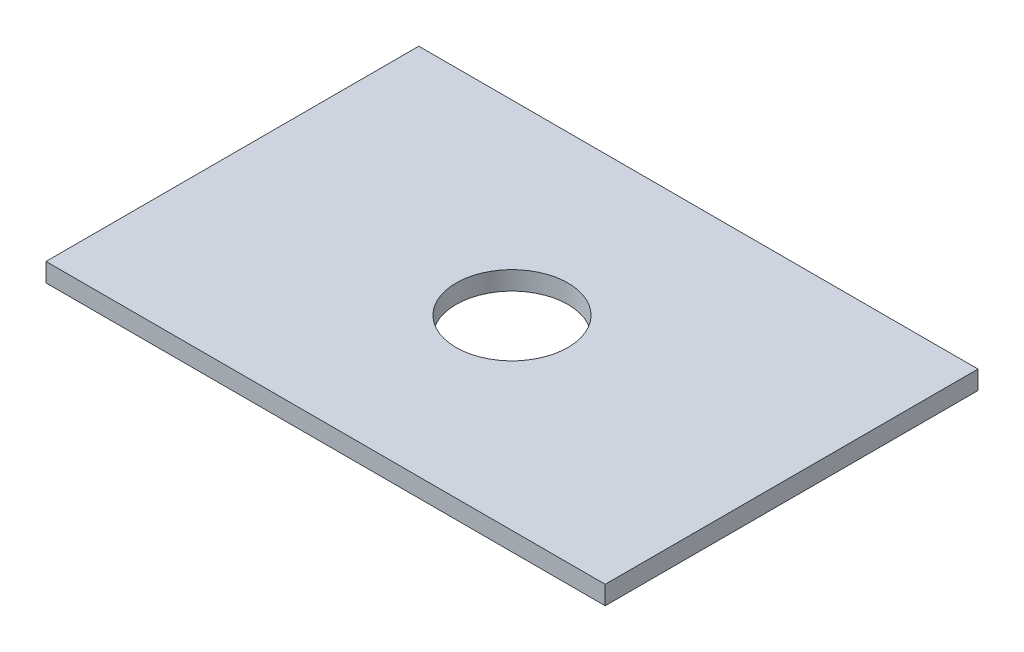
from build123d import *

# Parameters (mm, degrees)
CROQUIS1_W              = 300
CROQUIS1_H              = 200
SALIENTE_EXTRUIR1_DEPTH = 10
CROQUIS2_R              = 30
CORTAR_EXTRUIR1_DEPTH   = 10


with BuildPart() as part:
    # Croquis1 → Saliente-Extruir1 (new body)
    with BuildSketch(Plane(origin=(0, 0, 0), x_dir=(1, 0, 0), z_dir=(0, 1, 0))):
        Rectangle(CROQUIS1_W, CROQUIS1_H)
    extrude(amount=SALIENTE_EXTRUIR1_DEPTH)

    # Croquis2 → Cortar-Extruir1 (cut)
    with BuildSketch(Plane(origin=(0, 10, 0), x_dir=(1, 0, 0), z_dir=(0, 1, 0))):
        with Locations(Location((0, 0, 0), (0, 0, 270))):
            Circle(CROQUIS2_R)
    extrude(amount=-CORTAR_EXTRUIR1_DEPTH, mode=Mode.SUBTRACT)


solid = part.part
